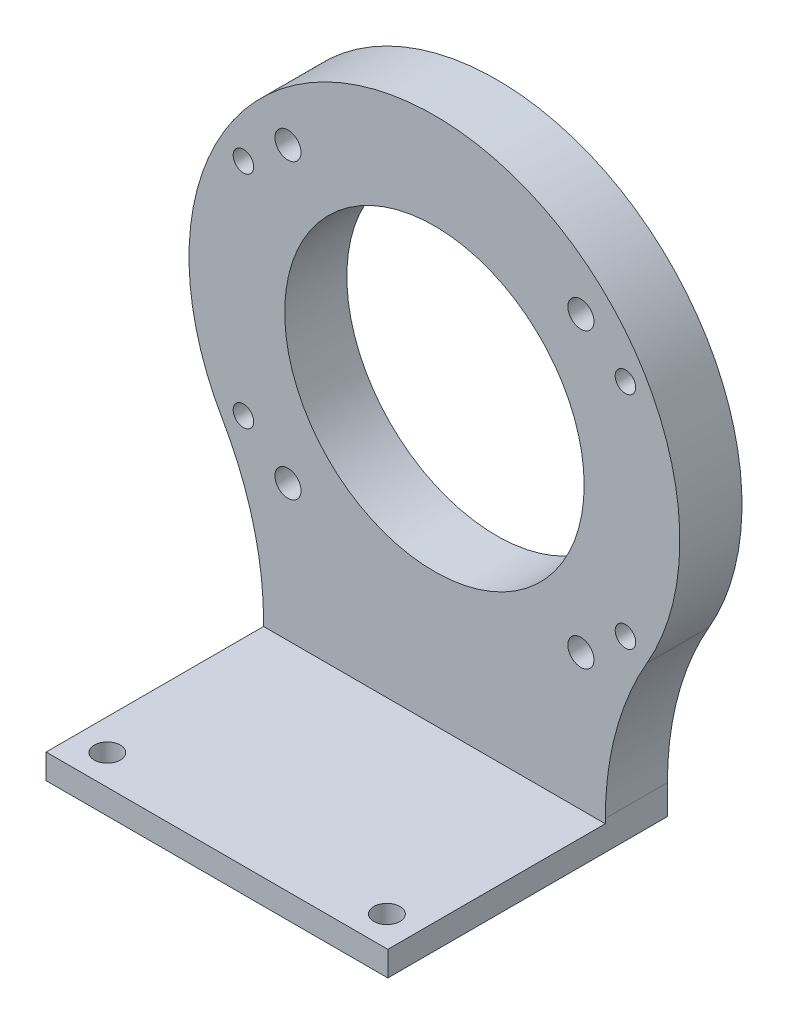
from build123d import *

# Parameters (mm, degrees)
SKETCH1_R                       = 24.1
BOSS_EXTRUDE1_DEPTH             = 10
TAP_DRILL_FOR_M5X0_8_TAP1_D     = 4.2
TAP_DRILL_FOR_M4X0_7_TAP1_D     = 3.3
SKETCH9_W                       = 55
SKETCH9_H                       = 45
BOSS_EXTRUDE2_DEPTH             = 4
TAP_DRILL_FOR_M5X0_8_TAP2_D     = 4.2
TAP_DRILL_FOR_M5X0_8_TAP2_DEPTH = 10
TAP_DRILL_FOR_M5X0_8_TAP2_TIP   = 1.2618073
FILLET1_R                       = 50


with BuildPart() as part:
    # Sketch1 → Boss-Extrude1 (new body)
    with BuildSketch(Plane.XY):
        with BuildLine():
            Line((-27.5, -28.354893758), (-27.5, -45.5))
            Line((-27.5, -45.5), (27.5, -45.5))
            Line((27.5, -45.5), (27.5, -28.354893758))
            ThreePointArc((27.5, -28.354893758), (0, 39.5), (-27.5, -28.354893758))
        make_face()
        Circle(SKETCH1_R, mode=Mode.SUBTRACT)
    extrude(amount=BOSS_EXTRUDE1_DEPTH)

    # Tap Drill for M5x0.8 Tap1 (through all)
    with Locations(Plane(origin=(23.573172318, 23.573172318, 0), x_dir=(-1, 0, 0), z_dir=(0, 0, -1))):
        with Locations((0, 0), (47.146344636, 0), (47.146344636, -47.146344636), (0, -47.146344636)):
            Hole(TAP_DRILL_FOR_M5X0_8_TAP1_D / 2)

    # Tap Drill for M4x0.7 Tap1 (through all)
    with Locations(Plane(origin=(-30.743901834, -17.75, 10), x_dir=(1, 0, 0), z_dir=(0, 0, 1))):
        with Locations((0, 0), (0, 35.5), (61.487803668, 35.5), (61.487803668, 0)):
            Hole(TAP_DRILL_FOR_M4X0_7_TAP1_D / 2)

    # Sketch9 → Boss-Extrude2 (add)
    with BuildSketch(Plane.XZ.offset(45.5)):
        with Locations((0, 22.5)):
            Rectangle(SKETCH9_W, SKETCH9_H)
    extrude(amount=BOSS_EXTRUDE2_DEPTH)

    # Tap Drill for M5x0.8 Tap2
    with Locations(Plane(origin=(-22.5, -49.5, 40.15274255), x_dir=(0, 0, -1), z_dir=(0, -1, 0))):
        with Locations((0, 0), (0, 45), (35, 45), (35, 0)):
            Hole(TAP_DRILL_FOR_M5X0_8_TAP2_D / 2, depth=TAP_DRILL_FOR_M5X0_8_TAP2_DEPTH)
            with Locations((0, 0, -(TAP_DRILL_FOR_M5X0_8_TAP2_DEPTH + TAP_DRILL_FOR_M5X0_8_TAP2_TIP / 2))):  # 118° drill point
                Cone(0, TAP_DRILL_FOR_M5X0_8_TAP2_D / 2, TAP_DRILL_FOR_M5X0_8_TAP2_TIP, mode=Mode.SUBTRACT)

    # Fillet1
    fillet1_edges = [part.edges().sort_by_distance(p)[0] for p in [
        (-27.5, -28.354893758, 5),
        (27.5, -28.354893758, 5),
    ]]
    fillet(fillet1_edges, radius=FILLET1_R)


solid = part.part
